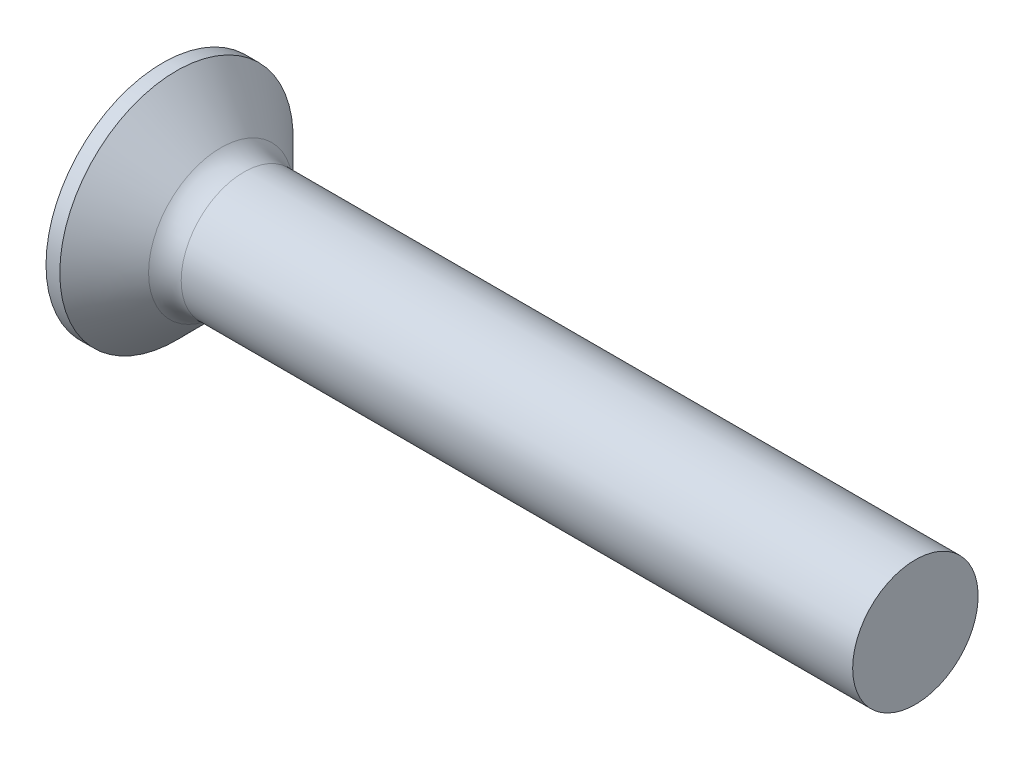
from build123d import *

# Parameters (mm, degrees)
FILLET1_R    = 1.3
RECPAT_COUNT = 2
RECPAT_ANGLE = 90


with BuildPart() as part:
    # BodySke → Base-Revolve (revolve)
    with BuildSketch(Plane.XY, mode=Mode.PRIVATE) as base_revolve_sk:
        Polygon((0, 0), (0, 4.65), (0.55, 4.65), (2.7, 2.5), (30, 2.5), (30, 0), align=None)
    revolve(base_revolve_sk.sketch.rotate(Axis((-6.35, 0, 0), (1, 0, 0)), 90), axis=Axis((-6.35, 0, 0), (1, 0, 0)))

    # Fillet1
    fillet1_edges = [part.edges().sort_by_distance(p)[0] for p in [
        (2.7, 0, -2.5),
    ]]
    fillet(fillet1_edges, radius=FILLET1_R)

    # Sketch3 → Recess section 0
    with BuildSketch(Plane.ZY):
        with BuildLine():
            Line((-0.515, 2.45), (0.515, 2.45))
            Line((0.515, 2.45), (0.515, -2.45))
            Line((0.515, -2.45), (-0.515, -2.45))
            Line((-0.515, -2.45), (-0.515, 2.45))
        make_face()
    # Sketch4 → Recess section 1
    with BuildSketch(Plane.ZY.offset(-3.05)):
        with BuildLine():
            Line((-0.515, 0.92932635), (0.515, 0.92932635))
            Line((0.515, 0.92932635), (0.515, -0.92932635))
            Line((0.515, -0.92932635), (-0.515, -0.92932635))
            Line((-0.515, -0.92932635), (-0.515, 0.92932635))
        make_face()
    recess = loft(mode=Mode.SUBTRACT)

    # RecPat: Recess ×2 about axis
    recpat_axis = Axis((0, 0, 0), (1, 0, 0))
    for i in range(1, RECPAT_COUNT):
        add(recess.rotate(recpat_axis, i * RECPAT_ANGLE / (RECPAT_COUNT - 1)), mode=Mode.SUBTRACT)

    # RecCorSke → RecessCore (revolve, cut)
    with BuildSketch(Plane.XY, mode=Mode.PRIVATE) as recesscore_sk:
        Polygon((0, 0), (0, 1.064276776), (3.05, 0.851), (3.326506661, 0), align=None)
    revolve(recesscore_sk.sketch.rotate(Axis((-3.175, 0, 0), (1, 0, 0)), 90), axis=Axis((-3.175, 0, 0), (1, 0, 0)), mode=Mode.SUBTRACT)


solid = part.part
